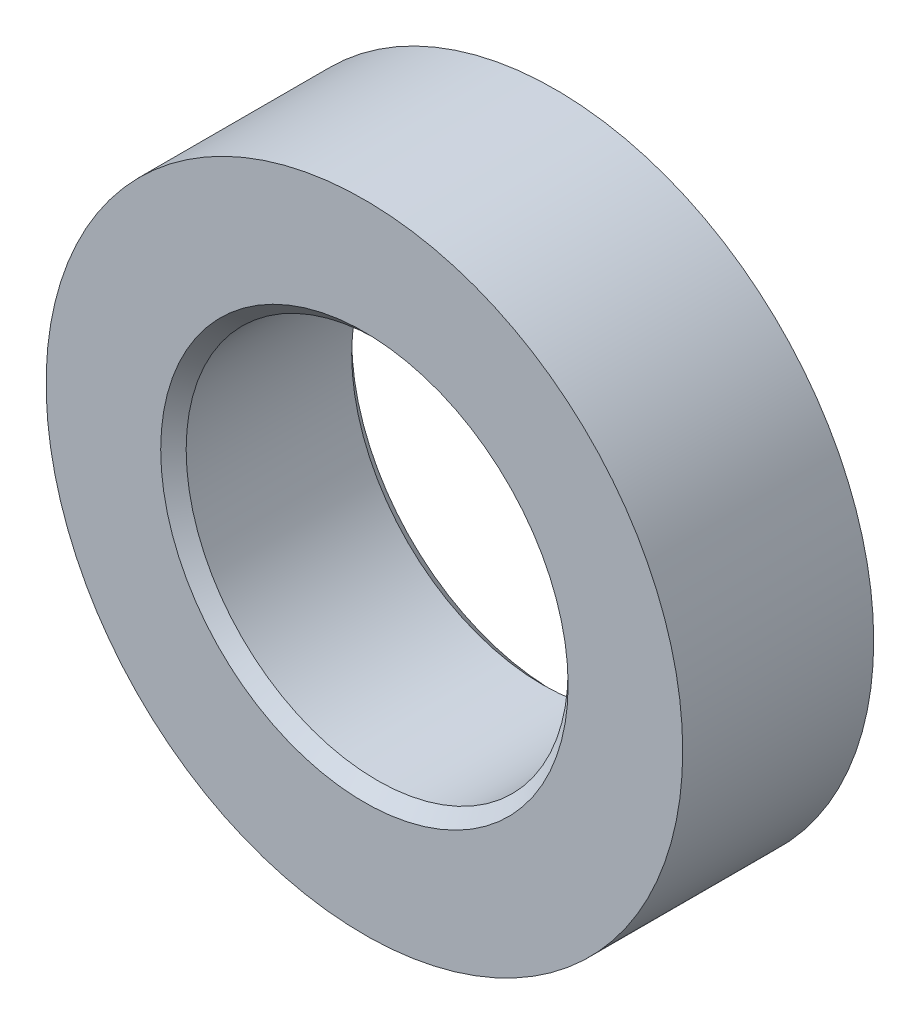
from build123d import *

# Parameters (mm, degrees)
SKETCH1_R           = 25
SKETCH1_R_2         = 15
BOSS_EXTRUDE1_DEPTH = 15
CHAMFER1_SIZE       = 1


with BuildPart() as part:
    # Sketch1 → Boss-Extrude1 (new body)
    with BuildSketch(Plane.XY):
        Circle(SKETCH1_R)
        Circle(SKETCH1_R_2, mode=Mode.SUBTRACT)
    extrude(amount=BOSS_EXTRUDE1_DEPTH)

    # Chamfer1
    chamfer1_edges = [part.edges().sort_by_distance(p)[0] for p in [
        (-15, 0, 0),
        (-15, 0, 15),
    ]]
    chamfer(chamfer1_edges, length=CHAMFER1_SIZE)


solid = part.part
